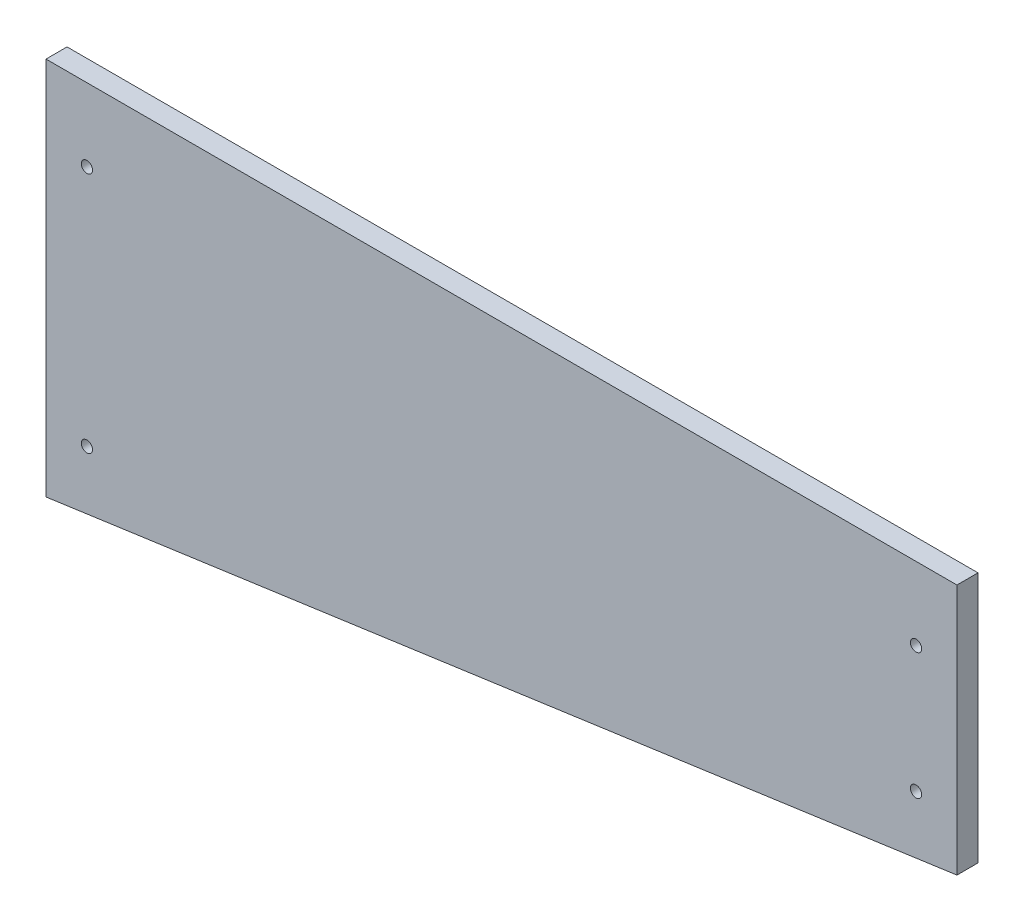
from build123d import *

# Parameters (mm, degrees)
SKETCH1_W            = 274.7772
SKETCH1_H            = 114.4016
BOSS_EXTRUDE1_DEPTH  = 6.35
M3_CLEARANCE_HOLE1_D = 3.4
CUT_EXTRUDE2_DEPTH   = 298.708848075


with BuildPart() as part:
    # Sketch1 → Boss-Extrude1 (new body)
    with BuildSketch(Plane.XY):
        with Locations((137.3886, 57.2008)):
            Rectangle(SKETCH1_W, SKETCH1_H)
    extrude(amount=BOSS_EXTRUDE1_DEPTH)

    # M3 Clearance Hole1 (through all)
    with Locations(Plane.XY.offset(6.35)):
        with Locations((12.3444, 92.4052), (12.3444, 19.3802), (262.4328, 54.3052), (262.4328, 92.4052)):
            Hole(M3_CLEARANCE_HOLE1_D / 2)

    # Sketch5 → Cut-Extrude2 (cut, through all)
    with BuildSketch(Plane.XY.offset(6.35)):
        Polygon((0, 0), (274.7772, 0), (274.7772, 38.617417045), align=None)
    extrude(amount=-CUT_EXTRUDE2_DEPTH, mode=Mode.SUBTRACT)


solid = part.part
